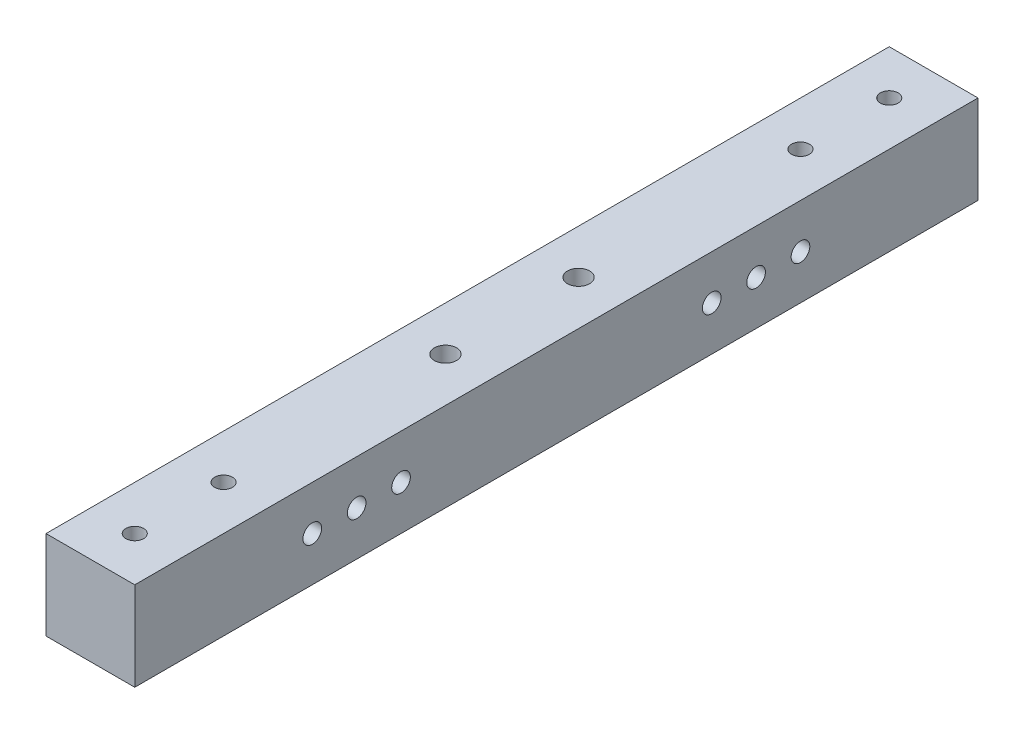
from build123d import *

# Parameters (mm, degrees)
SKETCH_1_W               = 20
SKETCH_1_H               = 20
EXTRUDE_1_DEPTH          = 190
CUT_EXTRUDE_1_DEPTH      = 193.093727123
CUT_EXTRUDE_1_DEPTH_BACK = 193.093727123
SKETCH_2_R               = 2
SKETCH_2_R_2             = 2.5
SKETCH_3_R               = 2.1
CUT_EXTRUDE_2_DEPTH      = 193.093727123


with BuildPart() as part:
    # 草图1 → 凸台-拉伸1 (new body)
    with BuildSketch(Plane.XY):
        with Locations((10, 10)):
            Rectangle(SKETCH_1_W, SKETCH_1_H)
    extrude(amount=EXTRUDE_1_DEPTH)

    # 草图2 → 切除-拉伸1 (cut, two sides: drawn at the far end of the back side and taken through both)
    with BuildSketch(Plane(origin=(0, 20, 0), x_dir=(1, 0, 0), z_dir=(0, 1, 0)).offset(-CUT_EXTRUDE_1_DEPTH_BACK)):
        with Locations(Location((10, -180, 0), (0, 0, 270))):
            Circle(SKETCH_2_R)
        with Locations(Location((10, -160, 0), (0, 0, 270))):
            Circle(SKETCH_2_R)
        with Locations(Location((10, -110, 0), (0, 0, 270))):
            Circle(SKETCH_2_R_2)
        with Locations(Location((10, -10, 0), (0, 0, 90))):
            Circle(SKETCH_2_R)
        with Locations(Location((10, -30, 0), (0, 0, 90))):
            Circle(SKETCH_2_R)
        with Locations(Location((10, -80, 0), (0, 0, 90))):
            Circle(SKETCH_2_R_2)
    extrude(amount=CUT_EXTRUDE_1_DEPTH + CUT_EXTRUDE_1_DEPTH_BACK, mode=Mode.SUBTRACT)

    # 草图3 → 切除-拉伸2 (cut, through all)
    with BuildSketch(Plane(origin=(20, 0, 0), x_dir=(0, 0, -1), z_dir=(1, 0, 0))):
        with Locations((-140, 10)):
            Circle(SKETCH_3_R)
        with Locations((-130, 10)):
            Circle(SKETCH_3_R)
        with Locations((-150, 10)):
            Circle(SKETCH_3_R)
        with Locations(Location((-60, 10, 0), (0, 0, 180))):
            Circle(SKETCH_3_R)
        with Locations(Location((-50, 10, 0), (0, 0, 180))):
            Circle(SKETCH_3_R)
        with Locations(Location((-40, 10, 0), (0, 0, 180))):
            Circle(SKETCH_3_R)
    extrude(amount=-CUT_EXTRUDE_2_DEPTH, mode=Mode.SUBTRACT)


solid = part.part
